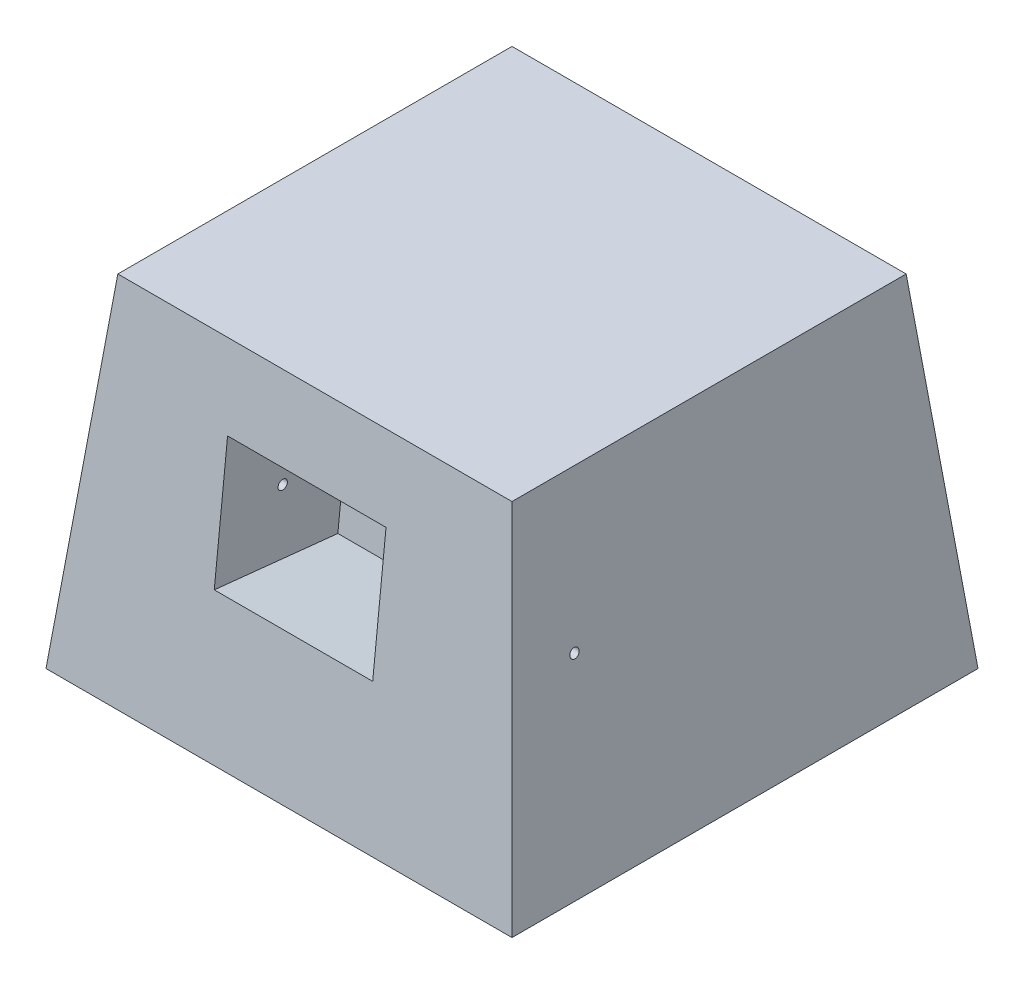
from build123d import *

# Parameters (mm, degrees)
SKETCH1_W               = 150
SKETCH1_H               = 150
BOSS_EXTRUDE1_DEPTH     = 110
BOSS_EXTRUDE1_TAPER     = 6
SKETCH14_W              = 51
SKETCH14_H              = 41
CUT_EXTRUDE2_DEPTH      = 40
CUT_EXTRUDE3_DEPTH      = 167.809022709
CUT_EXTRUDE3_DEPTH_BACK = 167.809022709
SKETCH23_R              = 1.5


with BuildPart() as part:
    # Sketch1 → Boss-Extrude1 (new body)
    with BuildSketch(Plane(origin=(0, 0, 0), x_dir=(1, 0, 0), z_dir=(0, 1, 0))):
        Rectangle(SKETCH1_W, SKETCH1_H)
    extrude(amount=BOSS_EXTRUDE1_DEPTH, taper=BOSS_EXTRUDE1_TAPER)

    # Sketch14 → Cut-Extrude2 (cut)
    with BuildSketch(Plane(origin=(0, 7.796688406, 74.180535028), x_dir=(1, 0, 0), z_dir=(0, 0.10452846326765353, 0.9945218953682734))):
        with Locations((0, 57.266276007)):
            Rectangle(SKETCH14_W, SKETCH14_H)
    extrude(amount=-CUT_EXTRUDE2_DEPTH, mode=Mode.SUBTRACT)

    # Sketch23 → Cut-Extrude3 (cut, two sides: drawn at the far end of the back side and taken through both)
    with BuildSketch(Plane(origin=(-25.5, 0, 0), x_dir=(0, 0, -1), z_dir=(1, 0, 0)).offset(-CUT_EXTRUDE3_DEPTH_BACK)):
        with Locations(Location((-48.304141292, 62.658684495, 0), (0, 0, 90))):
            Circle(SKETCH23_R)
    extrude(amount=CUT_EXTRUDE3_DEPTH + CUT_EXTRUDE3_DEPTH_BACK, mode=Mode.SUBTRACT)


solid = part.part
